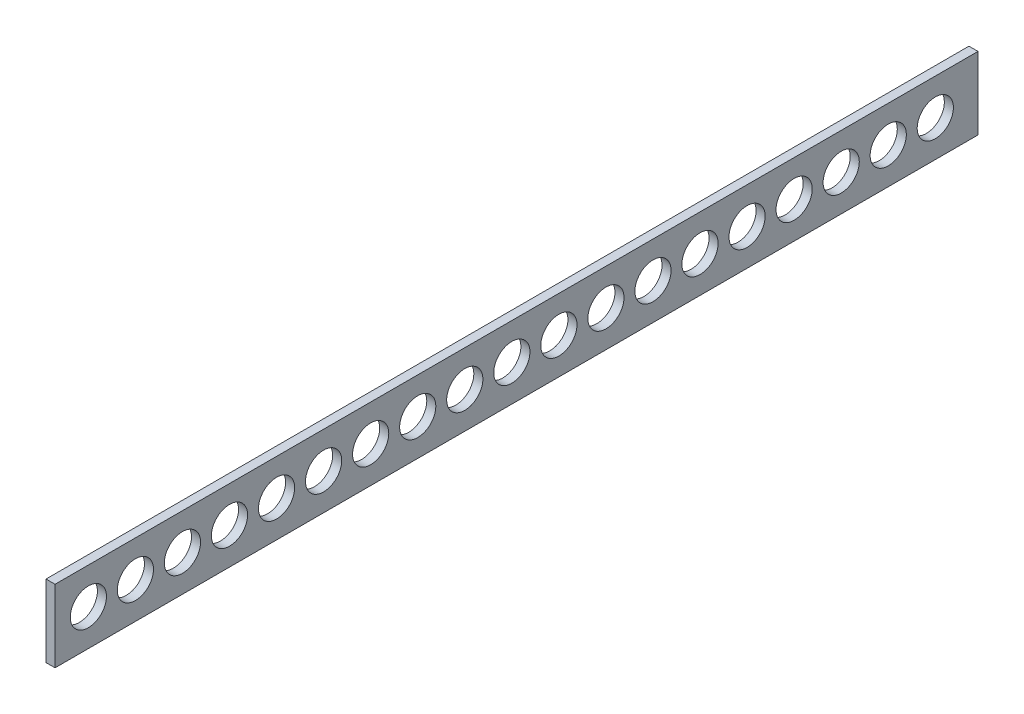
from build123d import *

# Parameters (mm, degrees)
SKETCH1_W           = 647.7
SKETCH1_H           = 50.8
SKETCH1_R           = 12.7
BOSS_EXTRUDE1_DEPTH = 6.35


with BuildPart() as part:
    # Sketch1 → Boss-Extrude1 (new body)
    with BuildSketch(Plane(origin=(0, 0, 0), x_dir=(0, 0, -1), z_dir=(1, 0, 0))):
        with Locations((323.85, 25.4)):
            Rectangle(SKETCH1_W, SKETCH1_H)
        with Locations((23.370832151, 25.4)):
            Circle(SKETCH1_R, mode=Mode.SUBTRACT)
        with Locations((56.390832151, 25.4)):
            Circle(SKETCH1_R, mode=Mode.SUBTRACT)
        with Locations((89.410832151, 25.4)):
            Circle(SKETCH1_R, mode=Mode.SUBTRACT)
        with Locations((122.430832151, 25.4)):
            Circle(SKETCH1_R, mode=Mode.SUBTRACT)
        with Locations((155.450832151, 25.4)):
            Circle(SKETCH1_R, mode=Mode.SUBTRACT)
        with Locations((188.470832151, 25.4)):
            Circle(SKETCH1_R, mode=Mode.SUBTRACT)
        with Locations((221.490832151, 25.4)):
            Circle(SKETCH1_R, mode=Mode.SUBTRACT)
        with Locations((254.510832151, 25.4)):
            Circle(SKETCH1_R, mode=Mode.SUBTRACT)
        with Locations((287.530832151, 25.4)):
            Circle(SKETCH1_R, mode=Mode.SUBTRACT)
        with Locations((320.550832151, 25.4)):
            Circle(SKETCH1_R, mode=Mode.SUBTRACT)
        with Locations((353.570832151, 25.4)):
            Circle(SKETCH1_R, mode=Mode.SUBTRACT)
        with Locations((386.590832151, 25.4)):
            Circle(SKETCH1_R, mode=Mode.SUBTRACT)
        with Locations((419.610832151, 25.4)):
            Circle(SKETCH1_R, mode=Mode.SUBTRACT)
        with Locations((452.630832151, 25.4)):
            Circle(SKETCH1_R, mode=Mode.SUBTRACT)
        with Locations((485.650832151, 25.4)):
            Circle(SKETCH1_R, mode=Mode.SUBTRACT)
        with Locations((518.670832151, 25.4)):
            Circle(SKETCH1_R, mode=Mode.SUBTRACT)
        with Locations((551.690832151, 25.4)):
            Circle(SKETCH1_R, mode=Mode.SUBTRACT)
        with Locations((584.710832151, 25.4)):
            Circle(SKETCH1_R, mode=Mode.SUBTRACT)
        with Locations((617.730832151, 25.4)):
            Circle(SKETCH1_R, mode=Mode.SUBTRACT)
    extrude(amount=BOSS_EXTRUDE1_DEPTH)


solid = part.part
